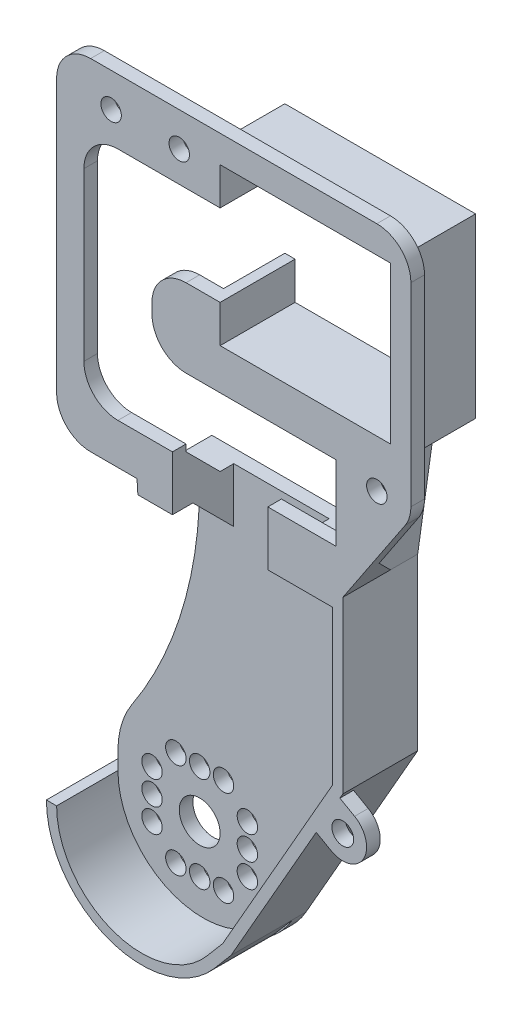
from build123d import *

# Parameters (mm, degrees)
EXTRUDE_1_DEPTH                 = 52
CUT_EXTRUDE_1_REACH             = 124.004
CUT_EXTRUDE_1_DIRECTION_2_DEPTH = 7
SKETCH_3_R                      = 1.5
SKETCH_3_R_2                    = 3
CUT_EXTRUDE_2_DEPTH             = 123.167917229
FILLET_1_R                      = 5
CHAMFER_1_SIZE                  = 5
FILLET_2_R                      = 12.5
EXTRUDE_2_DEPTH                 = 9
EXTRUDE_3_DEPTH                 = 9
EXTRUDE_3_DEPTH_BACK            = 2
CHAMFER_3_SIZE                  = 6
EXTRUDE_START                   = -11
SKETCH_7_R                      = 1.6
EXTRUDE_4_DEPTH                 = 2


with BuildPart() as part:
    # 草图1 → 凸台-拉伸1 (new body)
    with BuildSketch(Plane(origin=(0, 0, 0), x_dir=(0, 0, -1), z_dir=(1, 0, 0))):
        Polygon((0, 0), (0, 58), (-9, 58), (-9, 110), (-7, 110), (-7, 60), (2, 60), (2, 0), align=None)
    extrude(amount=EXTRUDE_1_DEPTH)

    # 草图2 → 切除-拉伸1 (cut, up to next)
    with BuildSketch(Plane(origin=(0, 0, 7), x_dir=(-1, 0, 0), z_dir=(0, 0, -1)), mode=Mode.PRIVATE) as cut_extrude_1_sk1:
        Polygon((-49, 106), (-49, 83), (-24, 83), (-24, 88.5), (-14, 88.5), (-14, 77), (-41, 77), (-41, 66), (-31, 66), (-31, 58), (-17, 58), (-17, 66), (-4, 66), (-4, 100.5), (-24, 100.5), (-24, 106), align=None)
    cut_extrude_1_tool1 = extrude(cut_extrude_1_sk1.sketch, amount=-CUT_EXTRUDE_1_REACH, mode=Mode.PRIVATE) & part.part
    add(cut_extrude_1_tool1.solids().sort_by_distance((25.692202, 84.595066, 7))[0], mode=Mode.SUBTRACT)

    # 草图2 → 切除-拉伸1 direction 2 (cut)
    with BuildSketch(Plane(origin=(0, 0, 7), x_dir=(-1, 0, 0), z_dir=(0, 0, -1))):
        Polygon((-49, 106), (-49, 83), (-24, 83), (-24, 88.5), (-14, 88.5), (-14, 77), (-41, 77), (-41, 66), (-31, 66), (-31, 58), (-17, 58), (-17, 66), (-4, 66), (-4, 100.5), (-24, 100.5), (-24, 106), align=None)
    extrude(amount=CUT_EXTRUDE_1_DIRECTION_2_DEPTH, mode=Mode.SUBTRACT)

    # 草图3 → 切除-拉伸2 (cut, through all)
    with BuildSketch(Plane(origin=(0, 0, -2), x_dir=(-1, 0, 0), z_dir=(0, 0, -1))):
        with Locations(Location((-15.5, 19, 0), (0, 0, 90))):
            Circle(SKETCH_3_R)
        with Locations(Location((-12, 19, 0), (0, 0, 90))):
            Circle(SKETCH_3_R)
        with Locations(Location((-8.5, 19, 0), (0, 0, 90))):
            Circle(SKETCH_3_R)
        with Locations(Location((-8.5, 5, 0), (0, 0, 90))):
            Circle(SKETCH_3_R)
        with Locations(Location((-12, 5, 0), (0, 0, 90))):
            Circle(SKETCH_3_R)
        with Locations(Location((-15.5, 5, 0), (0, 0, 90))):
            Circle(SKETCH_3_R)
        with Locations(Location((-5, 15.5, 0), (0, 0, 90))):
            Circle(SKETCH_3_R)
        with Locations(Location((-5, 12, 0), (0, 0, 90))):
            Circle(SKETCH_3_R)
        with Locations(Location((-5, 8.5, 0), (0, 0, 90))):
            Circle(SKETCH_3_R)
        with Locations(Location((-19, 8.5, 0), (0, 0, 90))):
            Circle(SKETCH_3_R)
        with Locations(Location((-19, 12, 0), (0, 0, 90))):
            Circle(SKETCH_3_R)
        with Locations(Location((-19, 15.5, 0), (0, 0, 90))):
            Circle(SKETCH_3_R)
        with Locations(Location((-8, 105, 0), (0, 0, 90))):
            Circle(SKETCH_3_R)
        with Locations(Location((-47, 76, 0), (0, 0, 90))):
            Circle(SKETCH_3_R)
        with Locations(Location((-18, 105, 0), (0, 0, 90))):
            Circle(SKETCH_3_R)
        with Locations(Location((-12, 12, 0), (0, 0, 90))):
            Circle(SKETCH_3_R_2)
        Polygon((-42, 35), (-22, 0), (-52, 0), (-52, 75), (-42, 60), align=None)
        with BuildLine():
            Line((0, 60), (-11.791303716, 60))
            ThreePointArc((-11.791303716, 60), (-9.662737441, 38.416613409), (0, 19))
            Line((0, 19), (0, 60))
        make_face()
    extrude(amount=-CUT_EXTRUDE_2_DEPTH, mode=Mode.SUBTRACT)

    # 圆角1
    fillet_1_edges = [part.edges().sort_by_distance(p)[0] for p in [
        (0, 60, 8),
        (52, 75, 8),
        (52, 110, 8),
        (14, 88.5, 8),
        (14, 77, 8),
        (4, 66, 8),
        (4, 100.5, 8),
        (0, 110, 8),
    ]]
    fillet(fillet_1_edges, radius=FILLET_1_R)

    # 倒角1
    chamfer_1_edges = [part.edges().sort_by_distance(p)[0] for p in [
        (36.5, 60, 7),
        (14.395651858, 60, 7),
    ]]
    chamfer(chamfer_1_edges, length=CHAMFER_1_SIZE)

    # 圆角2
    fillet_2_edges = [part.edges().sort_by_distance(p)[0] for p in [
        (0, 0, -1),
        (22, 0, -1),
        (0, 19, -1),
    ]]
    fillet(fillet_2_edges, radius=FILLET_2_R)

    # 草图4 → 凸台-拉伸2 (add)
    with BuildSketch(Plane(origin=(0, 0, 7), x_dir=(-1, 0, 0), z_dir=(0, 0, -1))):
        Polygon((-24, 88.5), (-24, 83), (-49, 83), (-49, 106), (-24, 106), (-24, 100.5), (-22.5, 100.5), (-22.5, 107.5), (-50.5, 107.5), (-50.5, 81.5), (-45, 81.5), (-42, 60), (-40.485467906, 60), (-43.485467906, 81.5), (-22.5, 81.5), (-22.5, 88.5), align=None)
    extrude(amount=EXTRUDE_2_DEPTH)

    # 草图6 → 凸台-拉伸3 (add, two sides: drawn at the far end of the back side and taken through both)
    with BuildSketch(Plane.XY.offset(-EXTRUDE_3_DEPTH_BACK)):
        with BuildLine():
            Line((42, 58), (42, 35))
            Line((42, 35), (25.599007583, 6.298263271))
            Line((25.599007583, 6.298263271), (23.114212107, 3.371007649))
            ThreePointArc((23.114212107, 3.371007649), (7.631682503, -0.626289832), (-1.5, 12.5))
            Line((-1.5, 12.5), (0, 12.5))
            ThreePointArc((0, 12.5), (8.295901466, 0.728188095), (22.172088883, 4.581622853))
            Line((22.172088883, 4.581622853), (24.370109829, 7.171038857))
            Line((24.370109829, 7.171038857), (40.5, 35.398346656))
            Line((40.5, 35.398346656), (40.5, 58))
            Line((40.5, 58), (42, 58))
        make_face()
    extrude(amount=EXTRUDE_3_DEPTH + EXTRUDE_3_DEPTH_BACK)

    # 倒角3
    chamfer_3_edges = [part.edges().sort_by_distance(p)[0] for p in [
        (14.462476533, 58, 0),
        (35.75, 58, 0),
    ]]
    chamfer(chamfer_3_edges, length=CHAMFER_3_SIZE)

    # 草图7 → 凸台-拉伸4 (add)
    with BuildSketch(Plane(origin=(0, 0, -2), x_dir=(-1, 0, 0), z_dir=(0, 0, -1)).offset(EXTRUDE_START)):
        with BuildLine():
            Line((-41.58264013, 34.269620228), (-43.736486284, 33.038850997))
            ThreePointArc((-43.736486284, 33.038850997), (-45.038850997, 28.263513716), (-40.263513716, 26.961149003))
            Line((-40.263513716, 26.961149003), (-38.109667562, 28.191918233))
            Line((-38.109667562, 28.191918233), (-41.58264013, 34.269620228))
        make_face()
        with Locations(Location((-42, 30, 0), (0, 0, 90))):
            Circle(SKETCH_7_R, mode=Mode.SUBTRACT)
    extrude(amount=EXTRUDE_4_DEPTH)


solid = part.part
